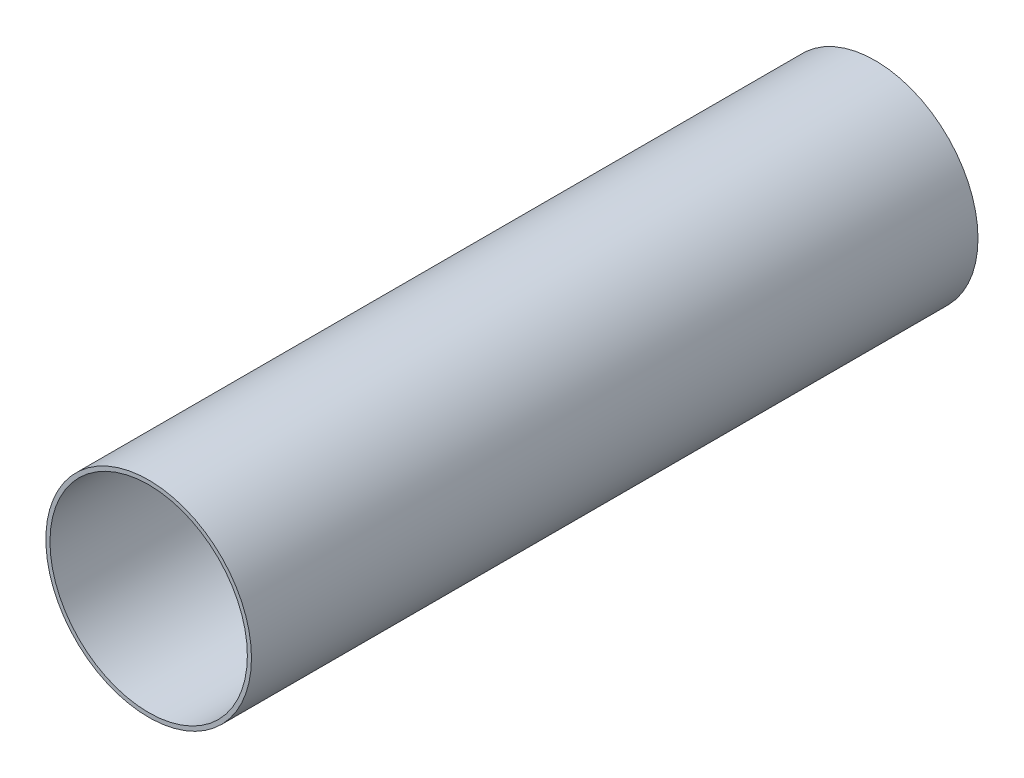
from build123d import *

# Parameters (mm, degrees)
PIPESKETCH_R   = 6.35
PIPESKETCH_R_2 = 6.096


with BuildPart() as part:
    # ThinSweep: sweep along a curve in space
    with BuildLine() as thinsweep_path:
        Line((0, 0, 7.698e-06), (0, 0, 44.87109601))
    # PipeSketch → ThinSweep (sweep)
    with BuildSketch(Plane.XY):
        Circle(PIPESKETCH_R)
        Circle(PIPESKETCH_R_2, mode=Mode.SUBTRACT)
    sweep(path=thinsweep_path.line)


solid = part.part
